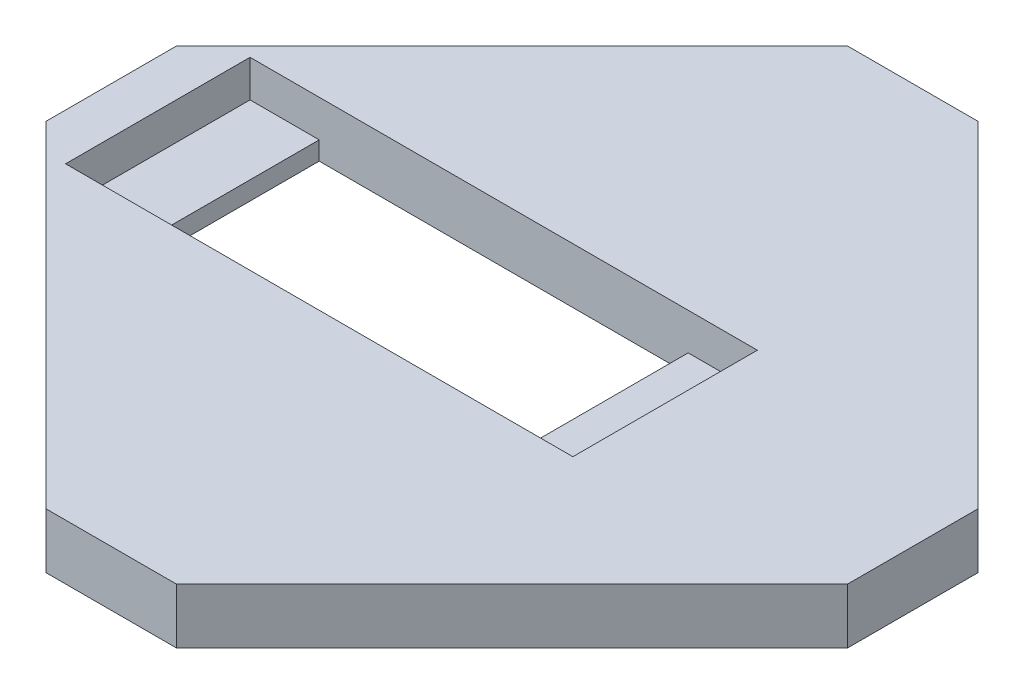
from build123d import *

# Parameters (mm, degrees)
BOSS_EXTRUDE1_DEPTH = 6
SKETCH1_3_W         = 7.5
SKETCH1_3_H         = 20
BOSS_EXTRUDE2_DEPTH = 2


with BuildPart() as part:
    # Sketch1 → Boss-Extrude1 (new body)
    with BuildSketch(Plane(origin=(0, 0, 0), x_dir=(1, 0, 0), z_dir=(0, 1, 0))):
        Polygon((43.450252532, 7.071067812), (7.071067812, 43.450252532), (-7.071067812, 43.450252532), (-43.450252532, 7.071067812), (-43.450252532, -7.071067812), (-7.071067812, -43.450252532), (7.071067812, -43.450252532), (43.450252532, -7.071067812), align=None)
        Polygon((-30.9, -10), (-38.4, -10), (-38.4, 10), (-30.9, 10), (9.1, 10), (16.6, 10), (16.6, -10), (9.1, -10), align=None, mode=Mode.SUBTRACT)
    extrude(amount=BOSS_EXTRUDE1_DEPTH)

    # Sketch1<3> → Boss-Extrude2 (add)
    with BuildSketch(Plane(origin=(0, 0, 0), x_dir=(1, 0, 0), z_dir=(0, 1, 0))):
        with Locations((-34.65, 0)):
            Rectangle(SKETCH1_3_W, SKETCH1_3_H)
        with Locations((12.85, 0)):
            Rectangle(SKETCH1_3_W, SKETCH1_3_H)
    extrude(amount=BOSS_EXTRUDE2_DEPTH)


solid = part.part
